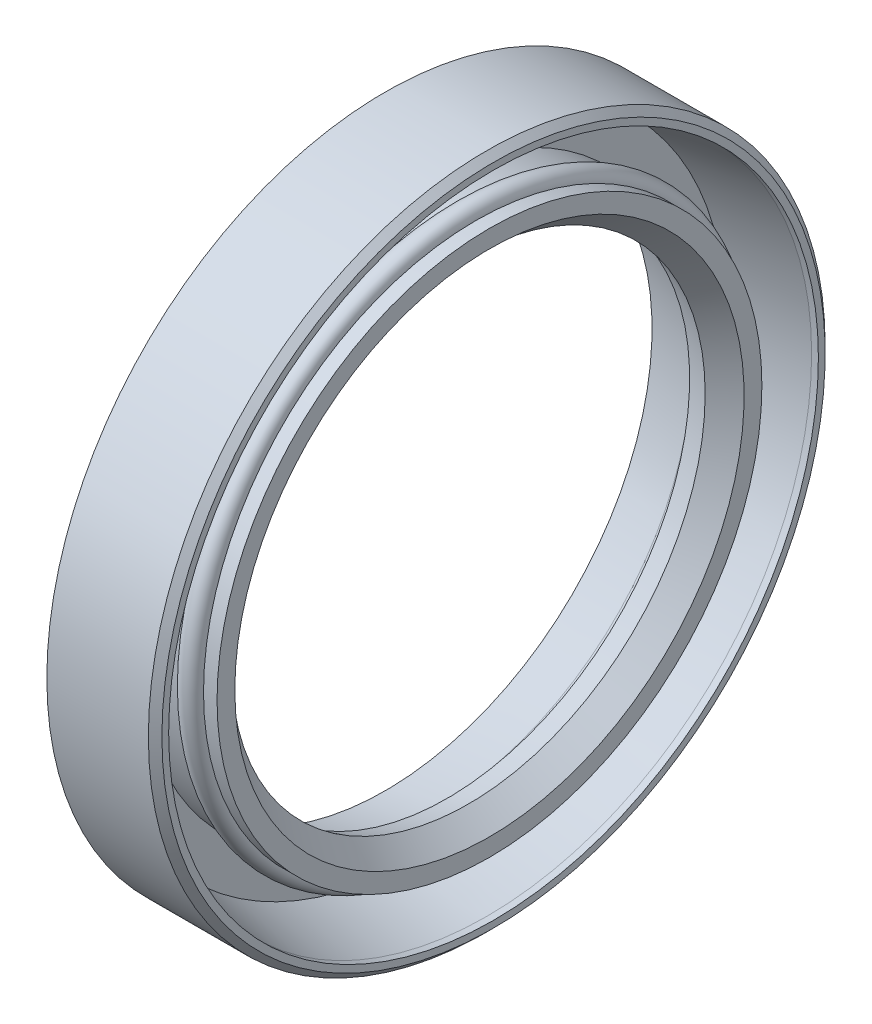
from build123d import *

# Parameters (mm, degrees)
SKETCH1_R = 0.5


with BuildPart() as part:
    # Sketch1 → Revolve1 (revolve)
    with BuildSketch(Plane.XY, mode=Mode.PRIVATE) as revolve1_sk:
        with BuildLine():
            Line((0, 25), (0, 19.71052516))
            Line((0, 19.71052516), (3.6, 19.075748029))
            ThreePointArc((3.6, 19.075748029), (4.295650509, 18.674114021), (4.570384351, 17.919288993))
            Line((4.570384351, 17.919288993), (6.135192176, 17.5))
            Line((6.135192176, 17.5), (7.7, 18.813029668))
            Line((7.7, 18.813029668), (7.7, 20.126059337))
            Line((7.7, 20.126059337), (6.7, 20.126059337))
            ThreePointArc((6.7, 20.126059337), (5.9, 20.926059337), (5.1, 20.126059337))
            Line((5.1, 20.126059337), (2.1, 20.126059337))
            Line((2.1, 20.126059337), (2.1, 23.047834304))
            Line((2.1, 23.047834304), (7.5, 24))
            Line((7.5, 24), (8, 24))
            Line((8, 24), (8, 24.5))
            Line((8, 24.5), (7.5, 25))
            Line((7.5, 25), (0, 25))
        make_face()
        with Locations((5.9, 20.126059337)):
            Circle(SKETCH1_R, mode=Mode.SUBTRACT)
    revolve(revolve1_sk.sketch.rotate(Axis((0, 0, 0), (1, 0, 0)), 90), axis=Axis((0, 0, 0), (1, 0, 0)))


solid = part.part
